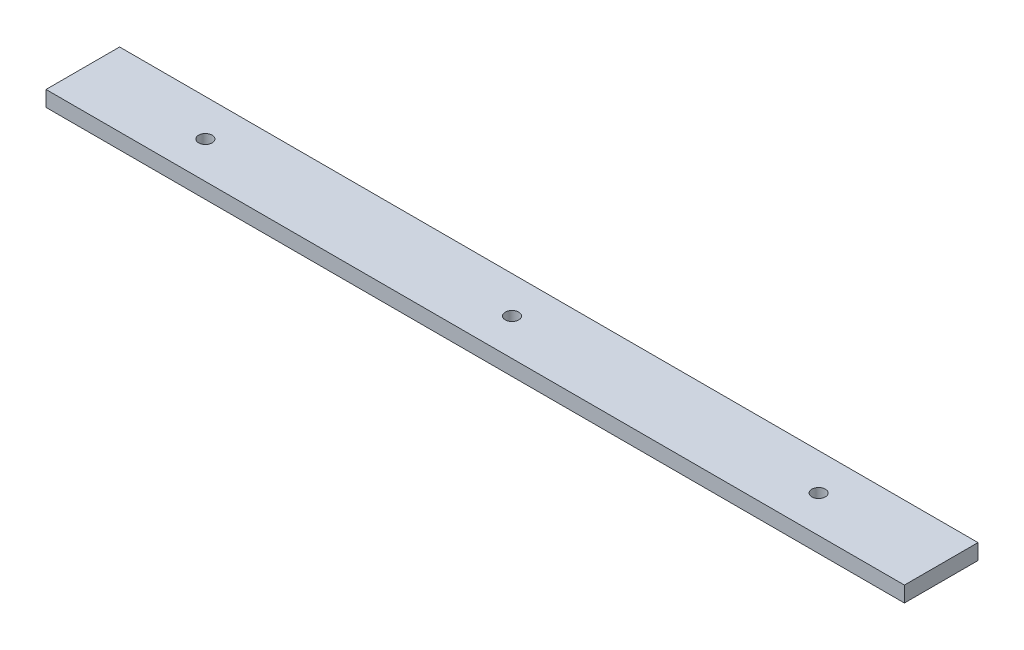
from build123d import *

# Parameters (mm, degrees)
SKETCH1_W            = 350
SKETCH1_H            = 30
BOSS_EXTRUDE1_DEPTH  = 6.35
M5_CLEARANCE_HOLE1_D = 5.5


with BuildPart() as part:
    # Sketch1 → Boss-Extrude1 (new body)
    with BuildSketch(Plane(origin=(0, 0, 0), x_dir=(1, 0, 0), z_dir=(0, 1, 0))):
        with Locations((175, 15)):
            Rectangle(SKETCH1_W, SKETCH1_H)
    extrude(amount=BOSS_EXTRUDE1_DEPTH)

    # M5 Clearance Hole1 (through all)
    with Locations(Plane(origin=(0, 6.35, 0), x_dir=(1, 0, 0), z_dir=(0, 1, 0))):
        with Locations((50, 15), (175, 15), (300, 15)):
            Hole(M5_CLEARANCE_HOLE1_D / 2)


solid = part.part
